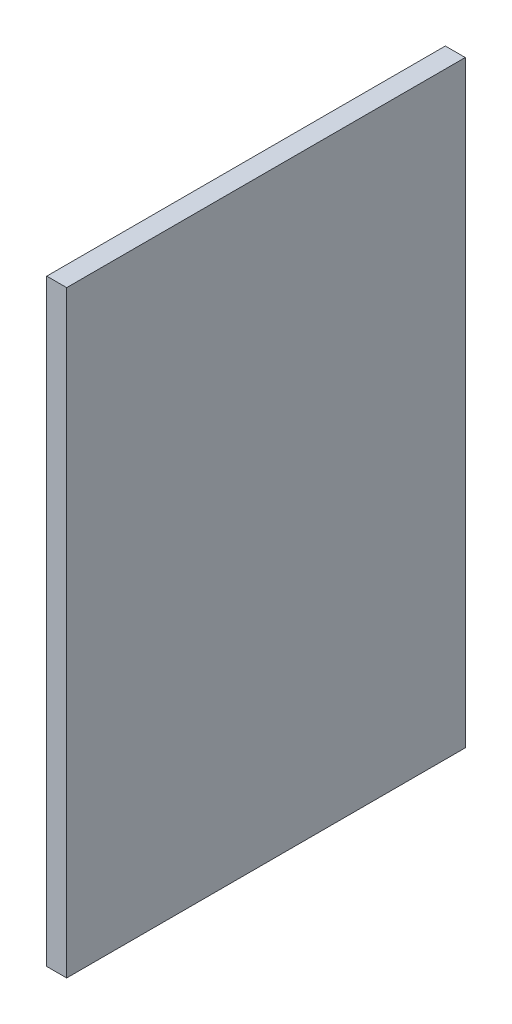
from build123d import *

# Parameters (mm, degrees)
CROQUIS1_W              = 10
CROQUIS1_H              = 300
SALIENTE_EXTRUIR1_DEPTH = 200


with BuildPart() as part:
    # Croquis1 → Saliente-Extruir1 (new body)
    with BuildSketch(Plane.XY):
        with Locations((5, 150)):
            Rectangle(CROQUIS1_W, CROQUIS1_H)
    extrude(amount=SALIENTE_EXTRUIR1_DEPTH)


solid = part.part
